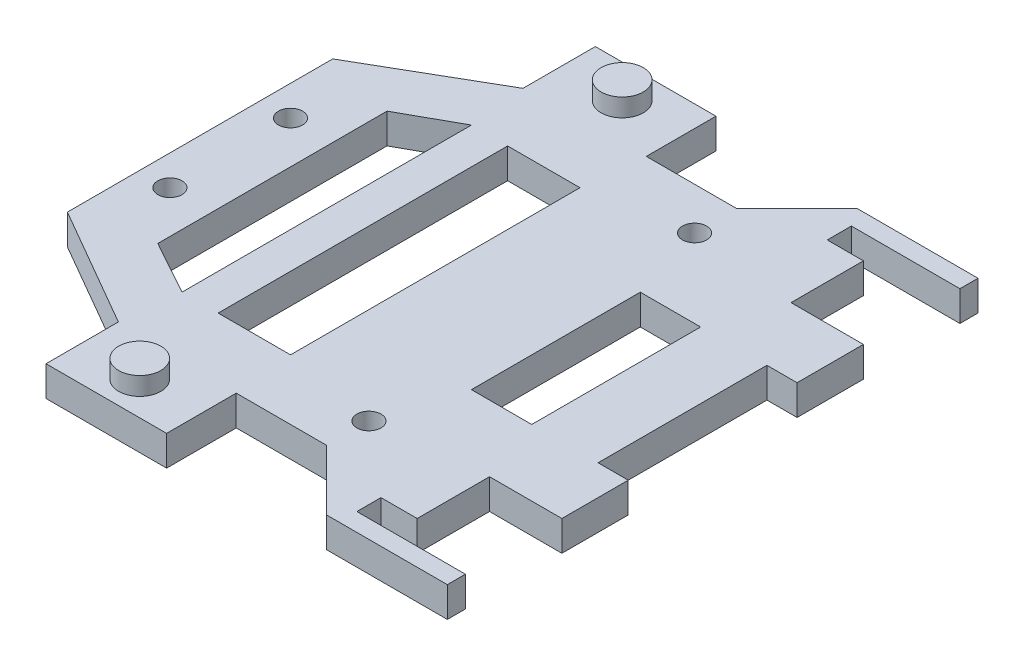
from build123d import *

# Parameters (mm, degrees)
SKETCH3_R           = 2
SKETCH3_R_2         = 3.5
SKETCH3_W           = 12
SKETCH3_H           = 48
SKETCH3_W_2         = 10
SKETCH3_H_2         = 28
BOSS_EXTRUDE1_DEPTH = 5
SKETCH3_2_R         = 3.5
BOSS_EXTRUDE2_DEPTH = 8


with BuildPart() as part:
    # Sketch3 → Boss-Extrude1 (new body)
    with BuildSketch(Plane(origin=(0, 0, 0), x_dir=(1, 0, 0), z_dir=(0, 1, 0))):
        Polygon((0, -22), (0, 22), (20, 33.547005384), (20, 45.547005384), (40, 45.547005384), (40, 34), (55, 34), (65, 44), (85, 44), (85, 41), (67, 41), (67, 37), (73, 37), (73, 25), (85, 25), (85, 14), (80, 14), (80, -14), (85, -14), (85, -25), (73, -25), (73, -37), (67, -37), (67, -41), (85, -41), (85, -44), (65, -44), (55, -34), (40, -34), (40, -45.547005384), (20, -45.547005384), (20, -33.547005384), align=None)
        with Locations((55, 27)):
            Circle(SKETCH3_R, mode=Mode.SUBTRACT)
        with Locations((30, 40)):
            Circle(SKETCH3_R_2, mode=Mode.SUBTRACT)
        with Locations((5, 10)):
            Circle(SKETCH3_R, mode=Mode.SUBTRACT)
        with Locations((5, -10)):
            Circle(SKETCH3_R, mode=Mode.SUBTRACT)
        with Locations((30, -40)):
            Circle(SKETCH3_R_2, mode=Mode.SUBTRACT)
        with Locations((55, -27)):
            Circle(SKETCH3_R, mode=Mode.SUBTRACT)
        with Locations((33, 0)):
            Rectangle(SKETCH3_W, SKETCH3_H, mode=Mode.SUBTRACT)
        with Locations((64, 0)):
            Rectangle(SKETCH3_W_2, SKETCH3_H_2, mode=Mode.SUBTRACT)
        Polygon((12, 19), (12, -19), (21, -24), (21, 24), align=None, mode=Mode.SUBTRACT)
    extrude(amount=BOSS_EXTRUDE1_DEPTH)

    # Sketch3<2> → Boss-Extrude2 (add)
    with BuildSketch(Plane(origin=(0, 0, 0), x_dir=(1, 0, 0), z_dir=(0, 1, 0))):
        with Locations((30, 40)):
            Circle(SKETCH3_2_R)
        with Locations((30, -40)):
            Circle(SKETCH3_2_R)
    extrude(amount=BOSS_EXTRUDE2_DEPTH)


solid = part.part
